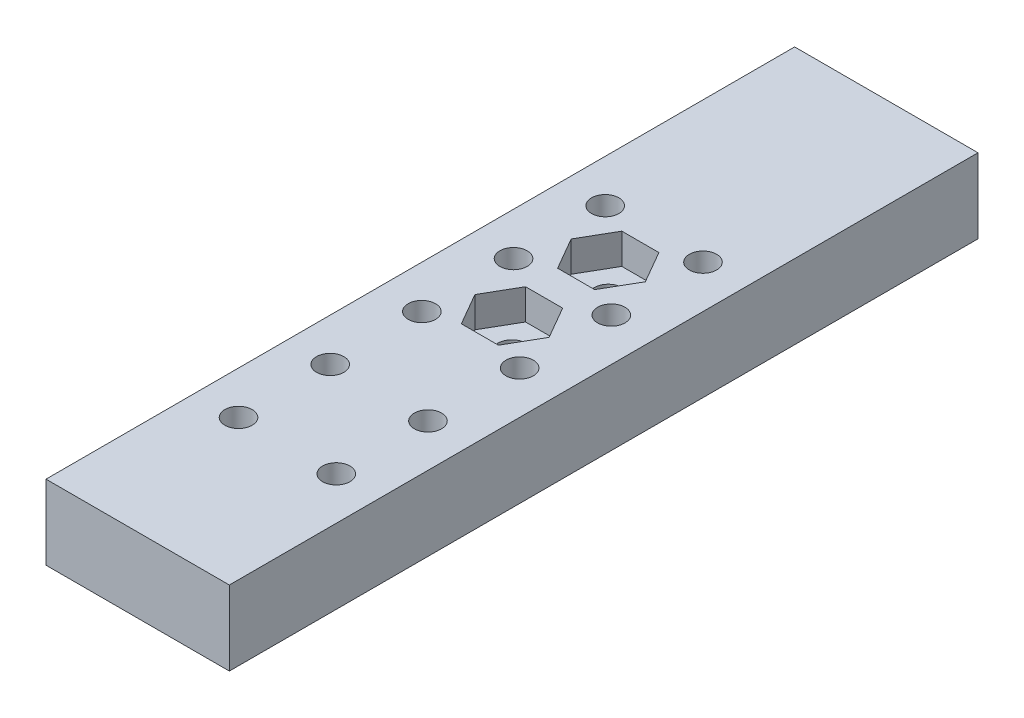
from build123d import *

# Parameters (mm, degrees)
SKETCH1_W           = 30
SKETCH1_H           = 122.5
SKETCH1_R           = 2.234949948
SKETCH1_R_2         = 2.3
BOSS_EXTRUDE1_DEPTH = 13
CUT_EXTRUDE1_DEPTH  = 5
CHAMFER1_SIZE       = 0.8
SKETCH3_R           = 4.5
CUT_EXTRUDE2_DEPTH  = 8
CHAMFER2_SIZE       = 0.8


with BuildPart() as part:
    # Sketch1 → Boss-Extrude1 (new body)
    with BuildSketch(Plane(origin=(0, 0, 0), x_dir=(1, 0, 0), z_dir=(0, 1, 0))):
        Rectangle(SKETCH1_W, SKETCH1_H)
        with Locations(Location((-8, 23.25, 0), (0, 0, 90))):
            Circle(SKETCH1_R, mode=Mode.SUBTRACT)
        with Locations(Location((8, 23.25, 0), (0, 0, 90))):
            Circle(SKETCH1_R, mode=Mode.SUBTRACT)
        with Locations(Location((8, 8.25, 0), (0, 0, 90))):
            Circle(SKETCH1_R, mode=Mode.SUBTRACT)
        with Locations(Location((8, -6.75, 0), (0, 0, 90))):
            Circle(SKETCH1_R, mode=Mode.SUBTRACT)
        with Locations(Location((8, -21.75, 0), (0, 0, 90))):
            Circle(SKETCH1_R, mode=Mode.SUBTRACT)
        with Locations(Location((8, -36.75, 0), (0, 0, 90))):
            Circle(SKETCH1_R, mode=Mode.SUBTRACT)
        with Locations(Location((-8, 8.25, 0), (0, 0, 90))):
            Circle(SKETCH1_R, mode=Mode.SUBTRACT)
        with Locations(Location((-8, -6.75, 0), (0, 0, 90))):
            Circle(SKETCH1_R, mode=Mode.SUBTRACT)
        with Locations(Location((-8, -21.75, 0), (0, 0, 90))):
            Circle(SKETCH1_R, mode=Mode.SUBTRACT)
        with Locations(Location((-8, -36.75, 0), (0, 0, 90))):
            Circle(SKETCH1_R, mode=Mode.SUBTRACT)
        with Locations(Location((0, 15.75, 0), (0, 0, 90))):
            Circle(SKETCH1_R_2, mode=Mode.SUBTRACT)
        with Locations(Location((0, 0, 0), (0, 0, 90))):
            Circle(SKETCH1_R_2, mode=Mode.SUBTRACT)
    extrude(amount=BOSS_EXTRUDE1_DEPTH)

    # Sketch2 → Cut-Extrude1 (cut)
    with BuildSketch(Plane(origin=(0, 13, 0), x_dir=(1, 0, 0), z_dir=(0, 1, 0))):
        Polygon((6.066941319, 0), (3.033470659, 5.254125305), (-3.033470659, 5.254125305), (-6.066941319, 0), (-3.033470659, -5.254125305), (3.033470659, -5.254125305), align=None)
        Polygon((6.066941319, 15.75), (3.033470659, 21.004125305), (-3.033470659, 21.004125305), (-6.066941319, 15.75), (-3.033470659, 10.495874695), (3.033470659, 10.495874695), align=None)
    extrude(amount=-CUT_EXTRUDE1_DEPTH, mode=Mode.SUBTRACT)

    # Chamfer1
    chamfer1_edges = [part.edges().sort_by_distance(p)[0] for p in [
        (-15, 0, 0),
        (15, 0, 0),
    ]]
    chamfer(chamfer1_edges, length=CHAMFER1_SIZE)

    # Sketch3 → Cut-Extrude2 (cut)
    with BuildSketch(Plane.XZ):
        with Locations(Location((8, 36.75, 0), (0, 0, 270))):
            Circle(SKETCH3_R)
        with Locations(Location((-8, 36.75, 0), (0, 0, 270))):
            Circle(SKETCH3_R)
        with Locations(Location((-8, 21.75, 0), (0, 0, 270))):
            Circle(SKETCH3_R)
        with Locations(Location((-8, 6.75, 0), (0, 0, 270))):
            Circle(SKETCH3_R)
        with Locations(Location((-8, -8.25, 0), (0, 0, 270))):
            Circle(SKETCH3_R)
        with Locations(Location((-8, -23.25, 0), (0, 0, 270))):
            Circle(SKETCH3_R)
        with Locations(Location((8, 21.75, 0), (0, 0, 270))):
            Circle(SKETCH3_R)
        with Locations(Location((8, 6.75, 0), (0, 0, 270))):
            Circle(SKETCH3_R)
        with Locations(Location((8, -8.25, 0), (0, 0, 270))):
            Circle(SKETCH3_R)
        with Locations(Location((8, -23.25, 0), (0, 0, 270))):
            Circle(SKETCH3_R)
    extrude(amount=-CUT_EXTRUDE2_DEPTH, mode=Mode.SUBTRACT)

    # Chamfer2
    chamfer2_edges = [part.edges().sort_by_distance(p)[0] for p in [
        (0, 0, -61.25),
        (0, 0, 61.25),
    ]]
    chamfer(chamfer2_edges, length=CHAMFER2_SIZE)


solid = part.part
